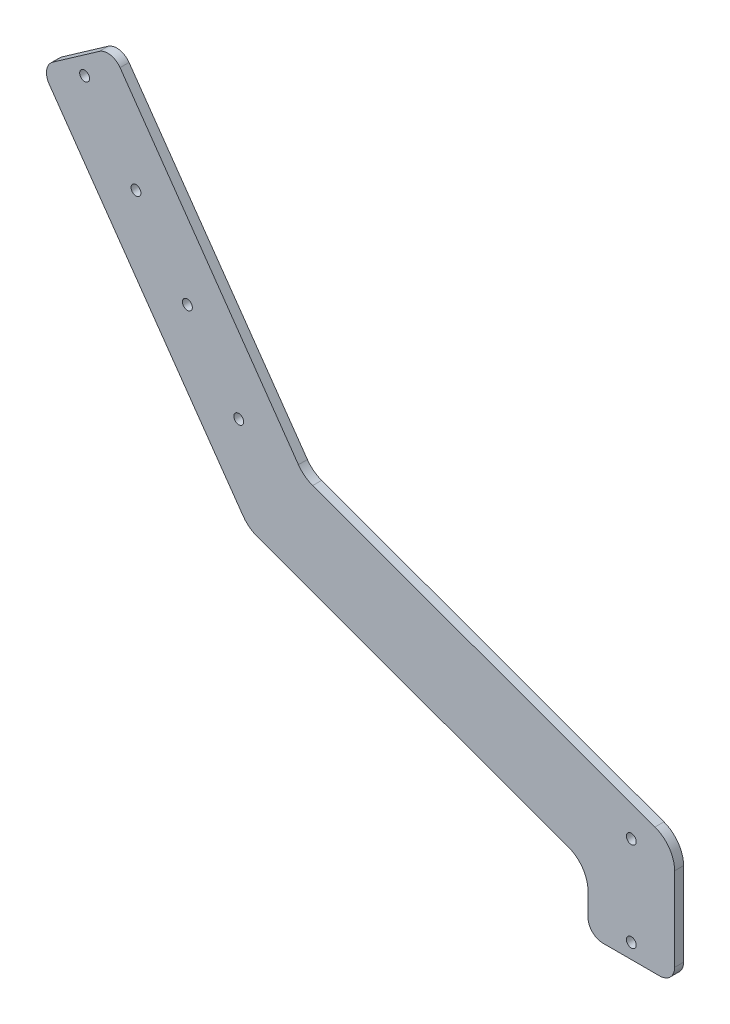
from build123d import *

# Parameters (mm, degrees)
SKETCH_1_R      = 1.65
EXTRUDE_1_DEPTH = 3
FILLET_1_R      = 10
FILLET_2_R      = 5


with BuildPart() as part:
    # 草图1 → 凸台-拉伸1 (new body)
    with BuildSketch(Plane.XY):
        Polygon((-14.5, -5), (14.5, -5), (14.5, 35), (-109.652000503, 80.187632708), (-174.042829775, 172.147267185), (-197.798239059, 155.513550531), (-128.162819072, 56.063864277), (-14.5, 14.693981392), align=None)
        Circle(SKETCH_1_R, mode=Mode.SUBTRACT)
        with Locations((0, 30)):
            Circle(SKETCH_1_R, mode=Mode.SUBTRACT)
        with Locations((-183.052652235, 159.734648636)):
            Circle(SKETCH_1_R, mode=Mode.SUBTRACT)
        with Locations((-165.845359145, 135.160087308)):
            Circle(SKETCH_1_R, mode=Mode.SUBTRACT)
        with Locations((-148.638066054, 110.585525979)):
            Circle(SKETCH_1_R, mode=Mode.SUBTRACT)
        with Locations((-131.430772964, 86.01096465)):
            Circle(SKETCH_1_R, mode=Mode.SUBTRACT)
    extrude(amount=EXTRUDE_1_DEPTH)

    # 圆角1
    fillet_1_edges = [part.edges().sort_by_distance(p)[0] for p in [
        (-14.5, 14.693981392, 1.5),
        (-128.162819072, 56.063864277, 1.5),
        (-109.652000503, 80.187632708, 1.5),
        (14.5, 35, 1.5),
    ]]
    fillet(fillet_1_edges, radius=FILLET_1_R)

    # 圆角2
    fillet_2_edges = [part.edges().sort_by_distance(p)[0] for p in [
        (-197.798239059, 155.513550531, 1.5),
        (-174.042829775, 172.147267185, 1.5),
        (14.5, -5, 1.5),
        (-14.5, -5, 1.5),
    ]]
    fillet(fillet_2_edges, radius=FILLET_2_R)


solid = part.part
